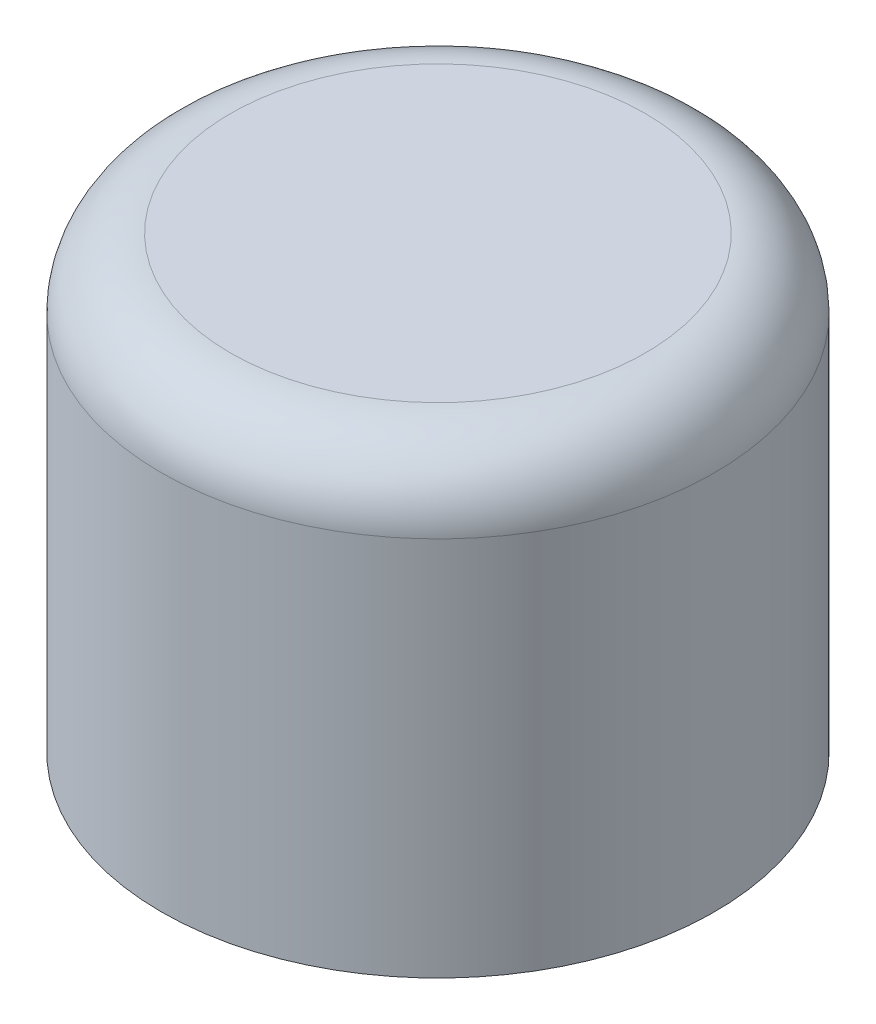
from build123d import *

# Parameters (mm, degrees)
SKETCH1_R           = 10.16
BOSS_EXTRUDE2_DEPTH = 16.51
SKETCH2_R           = 7.62
CUT_EXTRUDE1_DEPTH  = 12.7
FILLET2_R           = 2.54


with BuildPart() as part:
    # Sketch1 → Boss-Extrude2 (new body)
    with BuildSketch(Plane(origin=(0, 0, 0), x_dir=(1, 0, 0), z_dir=(0, 1, 0))):
        with Locations(Location((0, 0, 0), (0, 0, 270))):
            Circle(SKETCH1_R)
    extrude(amount=BOSS_EXTRUDE2_DEPTH)

    # Sketch2 → Cut-Extrude1 (cut)
    with BuildSketch(Plane(origin=(0, 0, 0), x_dir=(1, 0, 0), z_dir=(0, 1, 0))):
        with Locations(Location((0, 0, 0), (0, 0, 270))):
            Circle(SKETCH2_R)
    extrude(amount=CUT_EXTRUDE1_DEPTH, mode=Mode.SUBTRACT)

    # Fillet2
    fillet2_edges = [part.edges().sort_by_distance(p)[0] for p in [
        (0, 16.51, -10.16),
    ]]
    fillet(fillet2_edges, radius=FILLET2_R)


solid = part.part
